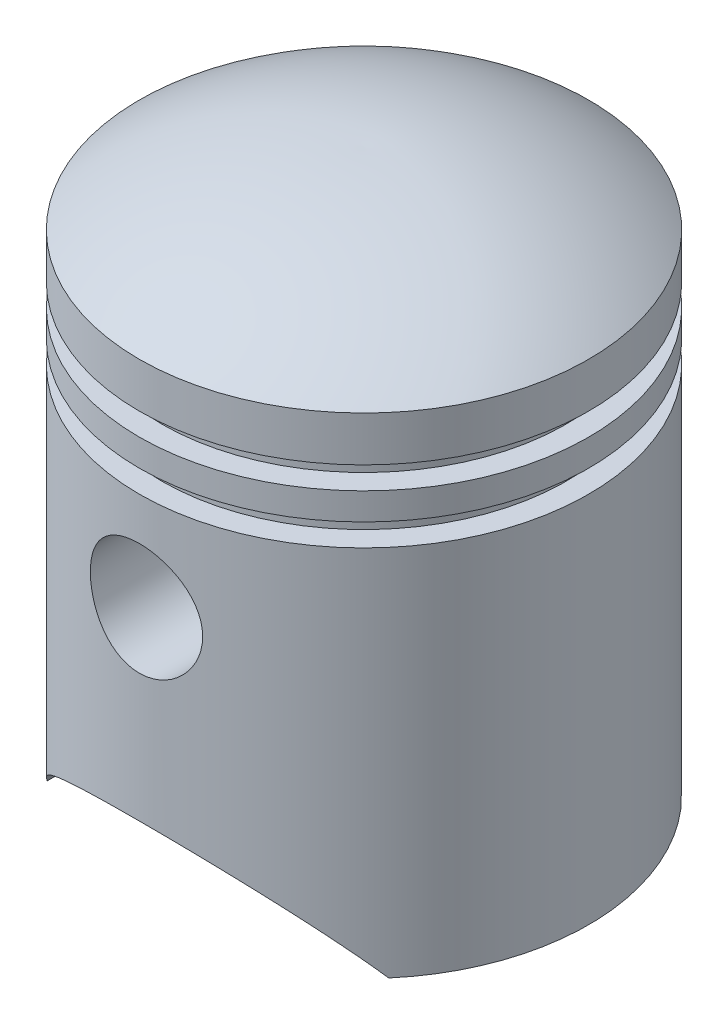
from build123d import *

# Parameters (mm, degrees)
CUT_EXTRUDE1_DEPTH       = 72.817566835
CUT_EXTRUDE1_DEPTH_BACK  = 72.817566835
SKETCH3_R                = 6.25
BOSS_EXTRUDE1_REACH      = 85.818
BOSS_EXTRUDE1_END_RADIUS = 23
BOSS_EXTRUDE1_START      = 12
SKETCH4_R                = 7.25
SKETCH4_R_2              = 6.25


with BuildPart() as part:
    # Sketch1 → Revolve1 (revolve)
    with BuildSketch(Plane.XY, mode=Mode.PRIVATE) as revolve1_sk:
        with BuildLine():
            Line((25, 0), (25, 41.5))
            Line((25, 41.5), (22.5, 41.5))
            Line((22.5, 41.5), (22.5, 44))
            Line((22.5, 44), (25, 44))
            Line((25, 44), (25, 47))
            Line((25, 47), (22.5, 47))
            Line((22.5, 47), (22.5, 49.5))
            Line((22.5, 49.5), (25, 49.5))
            Line((25, 49.5), (25, 54.5))
            ThreePointArc((25, 54.5), (13.174901691, 60.609067785), (0, 62.5))
            Line((0, 62.5), (0, 60.49936285))
            ThreePointArc((0, 60.49936285), (12.069492637, 58.859165445), (23, 53.484511145))
            Line((23, 53.484511145), (23, 51.5))
            Line((23, 51.5), (20.5, 51.5))
            Line((20.5, 51.5), (20.5, 45.5))
            Line((20.5, 45.5), (20.5, 39.5))
            Line((20.5, 39.5), (23, 39.5))
            Line((23, 39.5), (23, 0))
            Line((23, 0), (25, 0))
        make_face()
    revolve(revolve1_sk.sketch.rotate(Axis((0, 62.5, 0), (0, -1, 0)), 90), axis=Axis((0, 62.5, 0), (0, -1, 0)))

    # Sketch3 → Cut-Extrude1 (cut, two sides: drawn at the far end of the back side and taken through both)
    with BuildSketch(Plane.XY.offset(-CUT_EXTRUDE1_DEPTH_BACK)):
        with Locations((0, 30.5)):
            Circle(SKETCH3_R)
        with BuildLine():
            Line((-19, 0), (19, 0))
            ThreePointArc((19, 0), (0, 10), (-19, 0))
        make_face()
    extrude(amount=CUT_EXTRUDE1_DEPTH + CUT_EXTRUDE1_DEPTH_BACK, mode=Mode.SUBTRACT)

    # Boss-Extrude1: up to this cylinder (the profile starts inside it)
    boss_extrude1_end = Plane(origin=(0, 23.455061, 0), z_dir=(0, 1, 0)) * Cylinder(BOSS_EXTRUDE1_END_RADIUS, 218.636, mode=Mode.PRIVATE)
    # Sketch4 → Boss-Extrude1 (add, up to the surface)
    with BuildSketch(Plane.XY.offset(BOSS_EXTRUDE1_START), mode=Mode.PRIVATE) as boss_extrude1_sk1:
        with Locations(Location((0, 30.5, 0), (0, 0, 90))):
            Circle(SKETCH4_R)
        with Locations((0, 30.5)):
            Circle(SKETCH4_R_2, mode=Mode.SUBTRACT)
    boss_extrude1_tool1 = extrude(boss_extrude1_sk1.sketch, amount=BOSS_EXTRUDE1_REACH, mode=Mode.PRIVATE) & boss_extrude1_end
    boss_extrude1 = boss_extrude1_tool1.solids().sort_by_distance((0, 23.455061, 12))[0]
    add(boss_extrude1)

    # Mirror1: Boss-Extrude1 across plane
    add(boss_extrude1.mirror(Plane.XY))


solid = part.part
